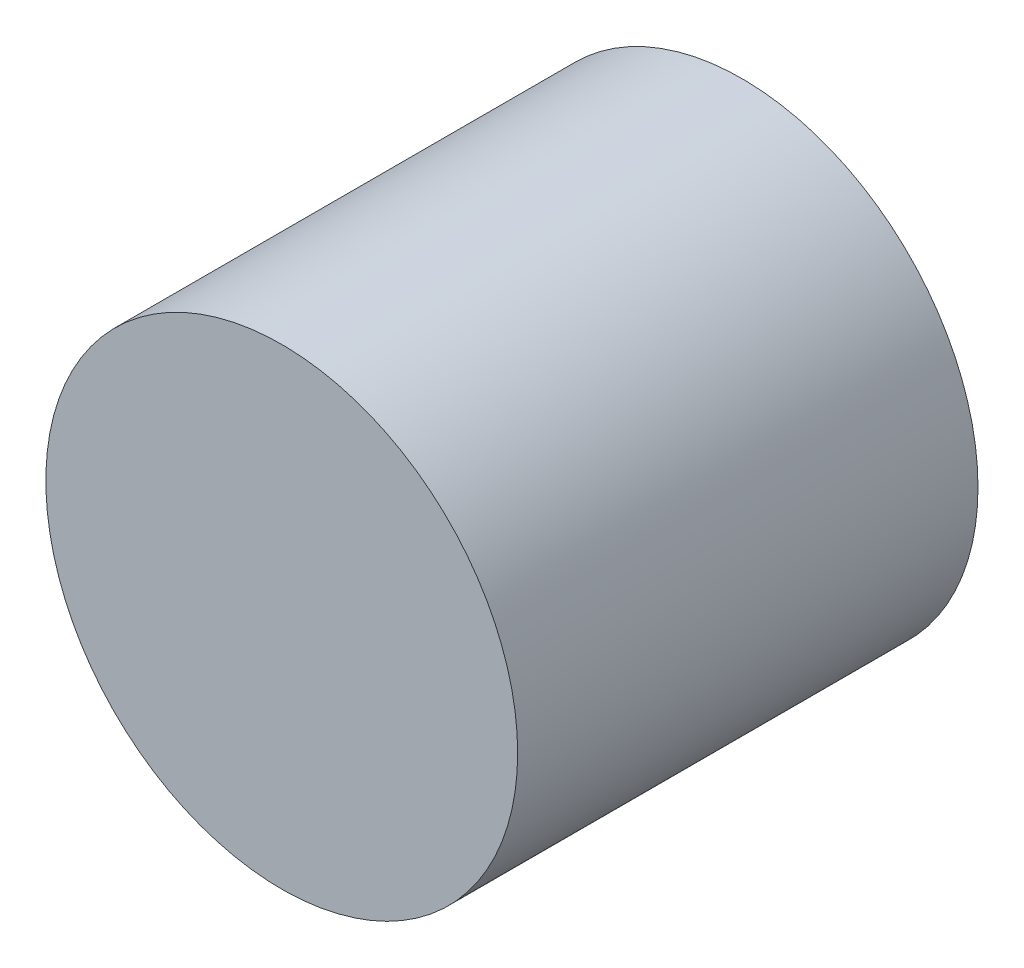
from build123d import *

# Parameters (mm, degrees)
SKETCH_1_R          = 50
EXTRUDE_1_DEPTH     = 8
SKETCH_3_OUTSIDE_W  = 130.33
SKETCH_3_OUTSIDE_H  = 130.33
SKETCH_3_OUTSIDE_R  = 4.1
CUT_EXTRUDE_2_DEPTH = 72.161787499


with BuildPart() as part:
    # 草图1 → 凸台-拉伸1 (new body)
    with BuildSketch(Plane.XY):
        Circle(SKETCH_1_R)
    extrude(amount=EXTRUDE_1_DEPTH)

    # 草图3 outside → 切除-拉伸2 (cut, through all)
    with BuildSketch(Plane.XY.offset(8)):
        Rectangle(SKETCH_3_OUTSIDE_W, SKETCH_3_OUTSIDE_H)
        with Locations((35, 0)):
            Circle(SKETCH_3_OUTSIDE_R, mode=Mode.SUBTRACT)
    extrude(amount=-CUT_EXTRUDE_2_DEPTH, mode=Mode.SUBTRACT)


solid = part.part
